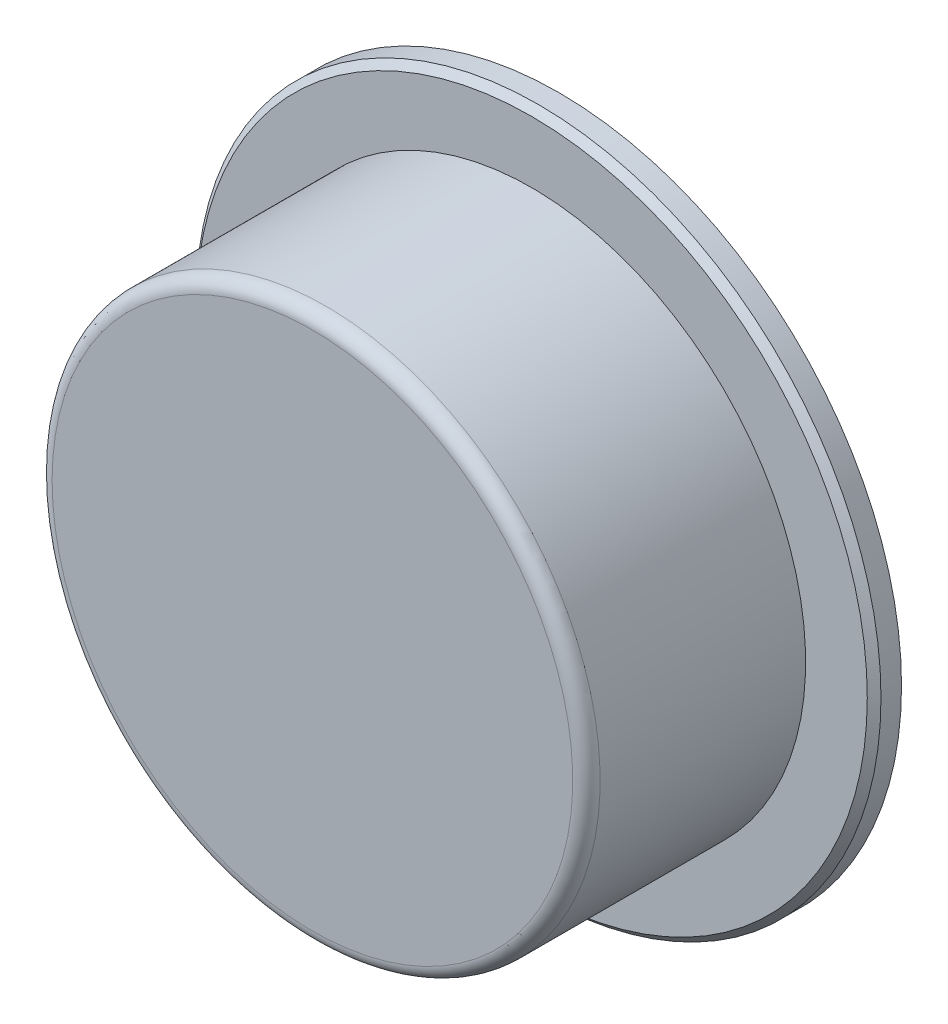
from build123d import *

# Parameters (mm, degrees)
CHANFREIN1_SIZE = 0.1


with BuildPart() as part:
    # Esquisse1 → Révolution1 (revolve)
    with BuildSketch(Plane.XZ, mode=Mode.PRIVATE) as r_volution1_sk:
        with BuildLine():
            Line((3.8, 3.6), (0, 3.6))
            Line((0, 3.6), (0, 0))
            Line((0, 0), (5, 0))
            Line((5, 0), (5, 0.4))
            Line((5, 0.4), (4, 0.4))
            Line((4, 0.4), (4, 3.4))
            ThreePointArc((4, 3.4), (3.941421356, 3.541421356), (3.8, 3.6))
        make_face()
    revolve(r_volution1_sk.sketch.rotate(Axis((0, 0, 3.6), (0, 0, -1)), 180), axis=Axis((0, 0, 3.6), (0, 0, -1)))

    # Chanfrein1
    chanfrein1_edges = [part.edges().sort_by_distance(p)[0] for p in [
        (5, 0, 0.4),
    ]]
    chamfer(chanfrein1_edges, length=CHANFREIN1_SIZE)


solid = part.part
